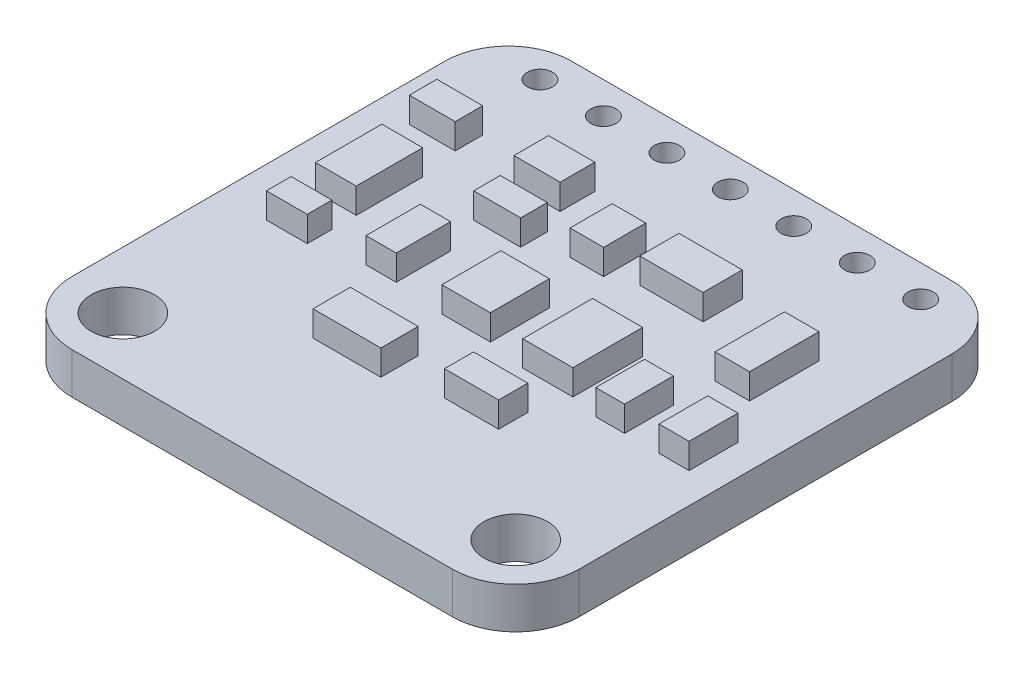
from build123d import *

# Parameters (mm, degrees)
PCB_DEPTH          = 1.651
SKETCH2_R          = 1.27
SKETCH2_R_2        = 0.508
CUT_EXTRUDE1_DEPTH = 15.343929064
SKETCH3_W          = 1.9431
SKETCH3_H          = 2.3622
SKETCH3_W_2        = 2.0066
SKETCH3_H_2        = 2.794
SKETCH3_W_3        = 2.16822249
SKETCH3_H_3        = 1.167787324
SKETCH3_W_4        = 2.716171955
SKETCH3_H_4        = 1.493517176
SKETCH3_W_5        = 1.209663862
SKETCH3_H_5        = 2.17508788
SKETCH3_W_6        = 1.633321627
SKETCH3_H_6        = 2.659890245
SKETCH3_W_7        = 1.834361491
SKETCH3_H_7        = 1.100221283
SKETCH3_W_8        = 1.848311781
SKETCH3_H_8        = 1.38602823
SKETCH3_W_9        = 1.877433771
SKETCH3_H_9        = 1.066217503
SKETCH3_H_10       = 0.988618516
SKETCH3_W_10       = 1.152895283
SKETCH3_H_11       = 1.952725423
SKETCH3_W_11       = 1.201658639
SKETCH3_W_12       = 1.378437796
SKETCH3_H_12       = 2.778082819
SKETCH3_W_13       = 2.534678464
SKETCH3_H_13       = 1.568516227
SKETCH3_W_14       = 1.344087022
SKETCH3_H_14       = 1.688234225
COMPONENTS_DEPTH   = 1.016


with BuildPart() as part:
    # Sketch1 → pcb (new body)
    with BuildSketch(Plane(origin=(0, 0, 0), x_dir=(1, 0, 0), z_dir=(0, 1, 0))):
        with BuildLine():
            Line((-7.61, -10), (7.61, -10))
            ThreePointArc((7.61, -10), (9.406051224, -9.256051224), (10.15, -7.46))
            Line((10.15, -7.46), (10.15, 7.46))
            ThreePointArc((10.15, 7.46), (9.406051224, 9.256051224), (7.61, 10))
            Line((7.61, 10), (-7.61, 10))
            ThreePointArc((-7.61, 10), (-9.406051224, 9.256051224), (-10.15, 7.46))
            Line((-10.15, 7.46), (-10.15, -7.46))
            ThreePointArc((-10.15, -7.46), (-9.406051224, -9.256051224), (-7.61, -10))
        make_face()
    extrude(amount=PCB_DEPTH)

    # Sketch2 → Cut-Extrude1 (cut, through all)
    with BuildSketch(Plane.XZ):
        with Locations(Location((-7.864, 7.714, 0), (0, 0, 270))):
            Circle(SKETCH2_R)
        with Locations(Location((7.864, 7.714, 0), (0, 0, 270))):
            Circle(SKETCH2_R)
        with Locations(Location((-7.61, -8.73, 0), (0, 0, 270))):
            Circle(SKETCH2_R_2)
        with Locations(Location((-5.07, -8.73, 0), (0, 0, 270))):
            Circle(SKETCH2_R_2)
        with Locations(Location((-2.53, -8.73, 0), (0, 0, 270))):
            Circle(SKETCH2_R_2)
        with Locations(Location((0.01, -8.73, 0), (0, 0, 270))):
            Circle(SKETCH2_R_2)
        with Locations(Location((2.55, -8.73, 0), (0, 0, 270))):
            Circle(SKETCH2_R_2)
        with Locations(Location((5.09, -8.73, 0), (0, 0, 270))):
            Circle(SKETCH2_R_2)
        with Locations(Location((7.63, -8.73, 0), (0, 0, 270))):
            Circle(SKETCH2_R_2)
    extrude(amount=-CUT_EXTRUDE1_DEPTH, mode=Mode.SUBTRACT)

    # Sketch3 → components (add)
    with BuildSketch(Plane(origin=(0, 1.651, 0), x_dir=(1, 0, 0), z_dir=(0, 1, 0))):
        with Locations((-0.47355, -0.1829)):
            Rectangle(SKETCH3_W, SKETCH3_H)
        with Locations((3.0507, -0.221)):
            Rectangle(SKETCH3_W_2, SKETCH3_H_2)
        with Locations((2.603432781, -3.639116092)):
            Rectangle(SKETCH3_W_3, SKETCH3_H_3)
        with Locations((-1.831635977, -4.030732119)):
            Rectangle(SKETCH3_W_4, SKETCH3_H_4)
        with Locations((-4.061190046, -0.08934394)):
            Rectangle(SKETCH3_W_5, SKETCH3_H_5)
        with Locations((-7.395465276, 1.673424229)):
            Rectangle(SKETCH3_W_6, SKETCH3_H_6)
        with Locations((-7.750024191, 5.108202568)):
            Rectangle(SKETCH3_W_7, SKETCH3_H_7)
        with Locations((-3.555135742, 5.251106041)):
            Rectangle(SKETCH3_W_8, SKETCH3_H_8)
        with Locations((-3.122473161, 3.062543074)):
            Rectangle(SKETCH3_W_9, SKETCH3_H_9)
        with Locations((-7.395465276, -1.123690742)):
            Rectangle(SKETCH3_W_6, SKETCH3_H_10)
        with Locations((5.77539067, -0.868377737)):
            Rectangle(SKETCH3_W_10, SKETCH3_H_11)
        with Locations((8.331105427, -0.868377737)):
            Rectangle(SKETCH3_W_11, SKETCH3_H_11)
        with Locations((7.041057209, 3.169050517)):
            Rectangle(SKETCH3_W_12, SKETCH3_H_12)
        with Locations((2.786660768, 4.379909938)):
            Rectangle(SKETCH3_W_13, SKETCH3_H_13)
        with Locations((-0.174043511, 4.013167629)):
            Rectangle(SKETCH3_W_14, SKETCH3_H_14)
    extrude(amount=COMPONENTS_DEPTH)


solid = part.part
